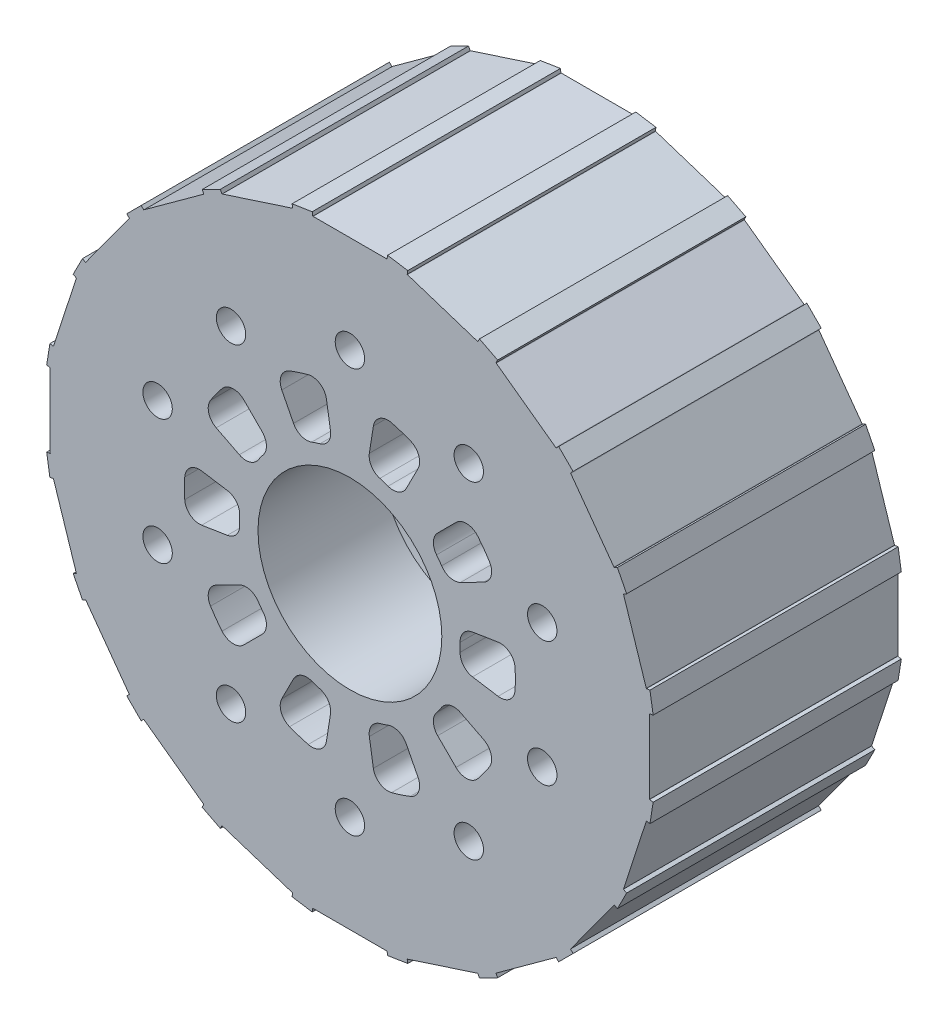
from build123d import *

# Parameters (mm, degrees)
SKETCH1_R           = 25
BOSS_EXTRUDE1_DEPTH = 67.5
SKETCH2_R           = 68
CUT_EXTRUDE1_DEPTH  = 33.75
SKETCH3_R           = 4
CUT_EXTRUDE2_DEPTH  = 33.75
CUT_EXTRUDE3_DEPTH  = 33.75


with BuildPart() as part:
    # Sketch1 → Boss-Extrude1 (new body)
    with BuildSketch(Plane.XY):
        Polygon((10, 81.5), (-10, 81.5), (-10.098768834, 81.484356553), (-10.255203299, 82.472044894), (-15.73198551, 81.604607809), (-15.575551045, 80.616919468), (-15.674319879, 80.601276022), (-34.695450205, 74.420936134), (-34.784550857, 74.375537084), (-35.238541357, 75.266543609), (-40.179217965, 72.749143139), (-39.725227466, 71.858136614), (-39.814328118, 71.812737564), (-55.994668006, 60.057032519), (-56.065378684, 59.986321841), (-56.772485465, 60.693428622), (-60.693428622, 56.772485465), (-59.986321841, 56.065378684), (-60.057032519, 55.994668006), (-71.812737564, 39.814328118), (-71.858136614, 39.725227466), (-72.749143139, 40.179217965), (-75.266543609, 35.238541357), (-74.375537084, 34.784550857), (-74.420936134, 34.695450205), (-80.601276022, 15.674319879), (-80.616919468, 15.575551045), (-81.604607809, 15.73198551), (-82.472044894, 10.255203299), (-81.484356553, 10.098768834), (-81.5, 10), (-81.5, -10), (-81.484356553, -10.098768834), (-82.472044894, -10.255203299), (-81.604607809, -15.73198551), (-80.616919468, -15.575551045), (-80.601276022, -15.674319879), (-74.420936134, -34.695450205), (-74.375537084, -34.784550857), (-75.266543609, -35.238541357), (-72.749143139, -40.179217965), (-71.858136614, -39.725227466), (-71.812737564, -39.814328118), (-60.057032519, -55.994668006), (-59.986321841, -56.065378684), (-60.693428622, -56.772485465), (-56.772485465, -60.693428622), (-56.065378684, -59.986321841), (-55.994668006, -60.057032519), (-39.814328118, -71.812737564), (-39.725227466, -71.858136614), (-40.179217965, -72.749143139), (-35.238541357, -75.266543609), (-34.784550857, -74.375537084), (-34.695450205, -74.420936134), (-15.674319879, -80.601276022), (-15.575551045, -80.616919468), (-15.73198551, -81.604607809), (-10.255203299, -82.472044894), (-10.098768834, -81.484356553), (-10, -81.5), (10, -81.5), (10.098768834, -81.484356553), (10.255203299, -82.472044894), (15.73198551, -81.604607809), (15.575551045, -80.616919468), (15.674319879, -80.601276022), (34.695450205, -74.420936134), (34.784550857, -74.375537084), (35.238541357, -75.266543609), (40.179217965, -72.749143139), (39.725227466, -71.858136614), (39.814328118, -71.812737564), (55.994668006, -60.057032519), (56.065378684, -59.986321841), (56.772485465, -60.693428622), (60.693428622, -56.772485465), (59.986321841, -56.065378684), (60.057032519, -55.994668006), (71.812737564, -39.814328118), (71.858136614, -39.725227466), (72.749143139, -40.179217965), (75.266543609, -35.238541357), (74.375537084, -34.784550857), (74.420936134, -34.695450205), (80.601276022, -15.674319879), (80.616919468, -15.575551045), (81.604607809, -15.73198551), (82.472044894, -10.255203299), (81.484356554, -10.098768834), (81.5, -10), (81.5, 10), (81.484356553, 10.098768834), (82.472044894, 10.255203299), (81.604607809, 15.73198551), (80.616919468, 15.575551045), (80.601276022, 15.674319879), (74.420936134, 34.695450205), (74.375537084, 34.784550857), (75.266543609, 35.238541357), (72.749143139, 40.179217965), (71.858136614, 39.725227466), (71.812737564, 39.814328118), (60.057032519, 55.994668006), (59.986321841, 56.065378684), (60.693428622, 56.772485465), (56.772485465, 60.693428622), (56.065378684, 59.986321841), (55.994668006, 60.057032519), (39.814328118, 71.812737564), (39.725227466, 71.858136614), (40.179217965, 72.749143139), (35.238541357, 75.266543609), (34.784550857, 74.375537084), (34.695450205, 74.420936134), (15.674319879, 80.601276022), (15.575551045, 80.616919468), (15.73198551, 81.604607809), (10.255203299, 82.472044894), (10.098768834, 81.484356553), align=None)
        Circle(SKETCH1_R, mode=Mode.SUBTRACT)
    extrude(amount=BOSS_EXTRUDE1_DEPTH)

    # Sketch2 → Cut-Extrude1 (cut)
    with BuildSketch(Plane(origin=(0, 0, 0), x_dir=(-1, 0, 0), z_dir=(0, 0, -1))):
        Circle(SKETCH2_R)
    extrude(amount=-CUT_EXTRUDE1_DEPTH, mode=Mode.SUBTRACT)

    # Sketch3 → Cut-Extrude2 (cut)
    with BuildSketch(Plane(origin=(0, 0, 33.75), x_dir=(-1, 0, 0), z_dir=(0, 0, -1))):
        with Locations((0, 55)):
            Circle(SKETCH3_R)
        with Locations((32.328188876, 44.495934691)):
            Circle(SKETCH3_R)
        with Locations((52.308108396, 16.995934691)):
            Circle(SKETCH3_R)
        with Locations((52.308108396, -16.995934691)):
            Circle(SKETCH3_R)
        with Locations((32.328188876, -44.495934691)):
            Circle(SKETCH3_R)
        with Locations((0, -55)):
            Circle(SKETCH3_R)
        with Locations((-32.328188876, -44.495934691)):
            Circle(SKETCH3_R)
        with Locations((-52.308108396, -16.995934691)):
            Circle(SKETCH3_R)
        with Locations((-52.308108396, 16.995934691)):
            Circle(SKETCH3_R)
        with Locations((-32.328188876, 44.495934691)):
            Circle(SKETCH3_R)
    extrude(amount=-CUT_EXTRUDE2_DEPTH, mode=Mode.SUBTRACT)

    # Sketch4 → Cut-Extrude3 (cut)
    with BuildSketch(Plane(origin=(0, 0, 33.75), x_dir=(-1, 0, 0), z_dir=(0, 0, -1))):
        with BuildLine():
            Line((-5.281835449, 33.348196567), (-6.383216288, 40.302041509))
            ThreePointArc((-6.383216288, 40.302041509), (-8.14367989, 43.023336778), (-11.342161812, 43.547162542))
            ThreePointArc((-11.342161812, 43.547162542), (-13.905764747, 42.797543233), (-16.420378262, 41.897149995))
            ThreePointArc((-16.420378262, 41.897149995), (-18.700107434, 39.593345547), (-18.52481518, 36.356996886))
            Line((-18.52481518, 36.356996886), (-15.328483493, 30.083842737))
            ThreePointArc((-15.328483493, 30.083842737), (-13.222545057, 28.175025497), (-10.380403585, 28.146886531))
            ThreePointArc((-10.380403585, 28.146886531), (-9.270509831, 28.531695489), (-8.146401893, 28.872757683))
            ThreePointArc((-8.146401893, 28.872757683), (-5.86360081, 30.566091427), (-5.281835449, 33.348196567))
        make_face()
        with BuildLine():
            Line((15.328483493, 30.083842737), (18.52481518, 36.356996886))
            ThreePointArc((18.52481518, 36.356996886), (18.700107434, 39.593345547), (16.420378262, 41.897149995))
            ThreePointArc((16.420378262, 41.897149995), (13.905764747, 42.797543233), (11.342161812, 43.547162542))
            ThreePointArc((11.342161812, 43.547162542), (8.14367989, 43.023336778), (6.383216288, 40.302041509))
            Line((6.383216288, 40.302041509), (5.281835449, 33.348196567))
            ThreePointArc((5.281835449, 33.348196567), (5.86360081, 30.566091427), (8.146401893, 28.872757683))
            ThreePointArc((8.146401893, 28.872757683), (9.270509831, 28.531695489), (10.380403585, 28.146886531))
            ThreePointArc((10.380403585, 28.146886531), (13.222545057, 28.175025497), (15.328483493, 30.083842737))
        make_face()
        with BuildLine():
            Line((30.083842737, 15.328483493), (36.356996886, 18.52481518))
            ThreePointArc((36.356996886, 18.52481518), (38.401089313, 21.040042045), (37.910891949, 24.243850182))
            ThreePointArc((37.910891949, 24.243850182), (36.405764747, 26.450336353), (34.77238158, 28.563639111))
            ThreePointArc((34.77238158, 28.563639111), (31.87685829, 30.019875669), (28.853076093, 28.853076093))
            Line((28.853076093, 28.853076093), (23.874672773, 23.874672773))
            ThreePointArc((23.874672773, 23.874672773), (22.710050465, 21.281949334), (23.561558733, 18.570216748))
            ThreePointArc((23.561558733, 18.570216748), (24.270509831, 17.633557569), (24.94224771, 16.669861403))
            ThreePointArc((24.94224771, 16.669861403), (27.25812813, 15.022057462), (30.083842737, 15.328483493))
        make_face()
        with BuildLine():
            Line((33.348196567, -5.281835449), (40.302041509, -6.383216288))
            ThreePointArc((40.302041509, -6.383216288), (43.434160278, -5.549842393), (44.920733454, -2.669776382))
            ThreePointArc((44.920733454, -2.669776382), (45, 0), (44.920733454, 2.669776382))
            ThreePointArc((44.920733454, 2.669776382), (43.434160278, 5.549842393), (40.302041509, 6.383216288))
            Line((40.302041509, 6.383216288), (33.348196567, 5.281835449))
            ThreePointArc((33.348196567, 5.281835449), (30.882032728, 3.868825943), (29.977000965, 1.174484194))
            ThreePointArc((29.977000965, 1.174484194), (30, 0), (29.977000965, -1.174484194))
            ThreePointArc((29.977000965, -1.174484194), (30.882032728, -3.868825943), (33.348196567, -5.281835449))
        make_face()
        with BuildLine():
            Line((23.874672773, -23.874672773), (28.853076093, -28.853076093))
            ThreePointArc((28.853076093, -28.853076093), (31.87685829, -30.019875669), (34.77238158, -28.563639111))
            ThreePointArc((34.77238158, -28.563639111), (36.405764747, -26.450336353), (37.910891949, -24.243850182))
            ThreePointArc((37.910891949, -24.243850182), (38.401089313, -21.040042045), (36.356996886, -18.52481518))
            Line((36.356996886, -18.52481518), (30.083842737, -15.328483493))
            ThreePointArc((30.083842737, -15.328483493), (27.25812813, -15.022057462), (24.94224771, -16.669861403))
            ThreePointArc((24.94224771, -16.669861403), (24.270509831, -17.633557569), (23.561558733, -18.570216748))
            ThreePointArc((23.561558733, -18.570216748), (22.710050465, -21.281949334), (23.874672773, -23.874672773))
        make_face()
        with BuildLine():
            Line((5.281835449, -33.348196567), (6.383216288, -40.302041509))
            ThreePointArc((6.383216288, -40.302041509), (8.14367989, -43.023336778), (11.342161812, -43.547162542))
            ThreePointArc((11.342161812, -43.547162542), (13.905764747, -42.797543233), (16.420378262, -41.897149995))
            ThreePointArc((16.420378262, -41.897149995), (18.700107434, -39.593345547), (18.52481518, -36.356996886))
            Line((18.52481518, -36.356996886), (15.328483493, -30.083842737))
            ThreePointArc((15.328483493, -30.083842737), (13.222545057, -28.175025497), (10.380403585, -28.146886531))
            ThreePointArc((10.380403585, -28.146886531), (9.270509831, -28.531695489), (8.146401893, -28.872757683))
            ThreePointArc((8.146401893, -28.872757683), (5.86360081, -30.566091427), (5.281835449, -33.348196567))
        make_face()
        with BuildLine():
            Line((-15.328483493, -30.083842737), (-18.52481518, -36.356996886))
            ThreePointArc((-18.52481518, -36.356996886), (-18.700107434, -39.593345547), (-16.420378262, -41.897149995))
            ThreePointArc((-16.420378262, -41.897149995), (-13.905764747, -42.797543233), (-11.342161812, -43.547162542))
            ThreePointArc((-11.342161812, -43.547162542), (-8.14367989, -43.023336778), (-6.383216288, -40.302041509))
            Line((-6.383216288, -40.302041509), (-5.281835449, -33.348196567))
            ThreePointArc((-5.281835449, -33.348196567), (-5.86360081, -30.566091427), (-8.146401893, -28.872757683))
            ThreePointArc((-8.146401893, -28.872757683), (-9.270509831, -28.531695489), (-10.380403585, -28.146886531))
            ThreePointArc((-10.380403585, -28.146886531), (-13.222545057, -28.175025497), (-15.328483493, -30.083842737))
        make_face()
        with BuildLine():
            Line((-30.083842737, 15.328483493), (-36.356996886, 18.52481518))
            ThreePointArc((-36.356996886, 18.52481518), (-38.401089313, 21.040042045), (-37.910891949, 24.243850182))
            ThreePointArc((-37.910891949, 24.243850182), (-36.405764747, 26.450336353), (-34.77238158, 28.563639111))
            ThreePointArc((-34.77238158, 28.563639111), (-31.87685829, 30.019875669), (-28.853076093, 28.853076093))
            Line((-28.853076093, 28.853076093), (-23.874672773, 23.874672773))
            ThreePointArc((-23.874672773, 23.874672773), (-22.710050465, 21.281949334), (-23.561558733, 18.570216748))
            ThreePointArc((-23.561558733, 18.570216748), (-24.270509831, 17.633557569), (-24.94224771, 16.669861403))
            ThreePointArc((-24.94224771, 16.669861403), (-27.25812813, 15.022057462), (-30.083842737, 15.328483493))
        make_face()
        with BuildLine():
            Line((-30.083842737, -15.328483493), (-36.356996886, -18.52481518))
            ThreePointArc((-36.356996886, -18.52481518), (-38.401089313, -21.040042045), (-37.910891949, -24.243850182))
            ThreePointArc((-37.910891949, -24.243850182), (-36.405764747, -26.450336353), (-34.77238158, -28.563639111))
            ThreePointArc((-34.77238158, -28.563639111), (-31.87685829, -30.019875669), (-28.853076093, -28.853076093))
            Line((-28.853076093, -28.853076093), (-23.874672773, -23.874672773))
            ThreePointArc((-23.874672773, -23.874672773), (-22.710050465, -21.281949334), (-23.561558733, -18.570216748))
            ThreePointArc((-23.561558733, -18.570216748), (-24.270509831, -17.633557569), (-24.94224771, -16.669861403))
            ThreePointArc((-24.94224771, -16.669861403), (-27.25812813, -15.022057462), (-30.083842737, -15.328483493))
        make_face()
        with BuildLine():
            Line((-33.348196567, 5.281835449), (-40.302041509, 6.383216288))
            ThreePointArc((-40.302041509, 6.383216288), (-43.434160278, 5.549842393), (-44.920733454, 2.669776382))
            ThreePointArc((-44.920733454, 2.669776382), (-45, 0), (-44.920733454, -2.669776382))
            ThreePointArc((-44.920733454, -2.669776382), (-43.434160278, -5.549842393), (-40.302041509, -6.383216288))
            Line((-40.302041509, -6.383216288), (-33.348196567, -5.281835449))
            ThreePointArc((-33.348196567, -5.281835449), (-30.882032728, -3.868825943), (-29.977000965, -1.174484194))
            ThreePointArc((-29.977000965, -1.174484194), (-30, 0), (-29.977000965, 1.174484194))
            ThreePointArc((-29.977000965, 1.174484194), (-30.882032728, 3.868825943), (-33.348196567, 5.281835449))
        make_face()
    extrude(amount=-CUT_EXTRUDE3_DEPTH, mode=Mode.SUBTRACT)


solid = part.part
